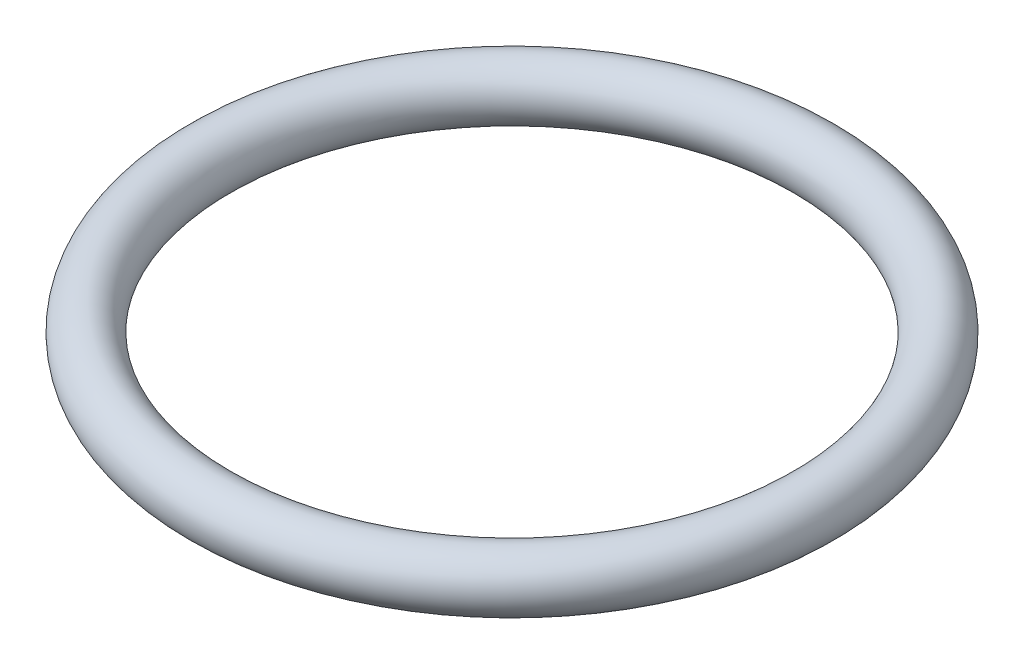
from build123d import *

# Parameters (mm, degrees)
ESQUISSE1_R = 0.6


with BuildPart() as part:
    # Esquisse1 → Base-Révolution (revolve)
    with BuildSketch(Plane.XY, mode=Mode.PRIVATE) as base_r_volution_sk:
        with Locations((6.4, 0)):
            Circle(ESQUISSE1_R)
    revolve(base_r_volution_sk.sketch.rotate(Axis((0, 13.171313942, 0), (0, -1, 0)), 90), axis=Axis((0, 13.171313942, 0), (0, -1, 0)))


solid = part.part
